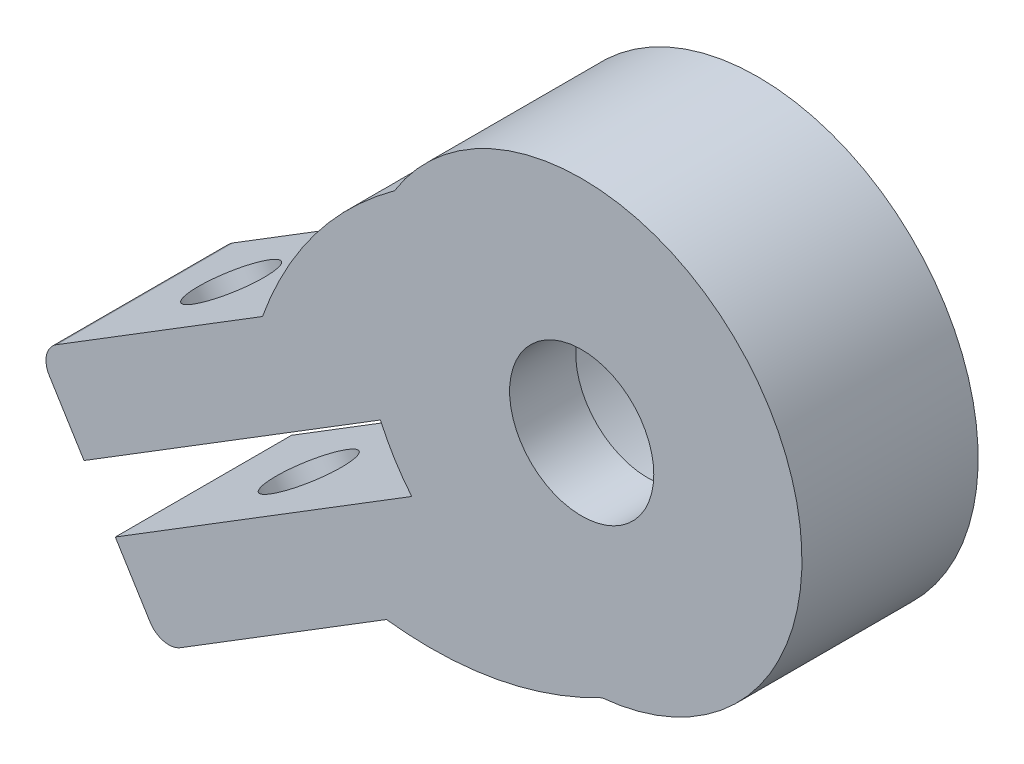
from build123d import *

# Parameters (mm, degrees)
SKETCH1_R               = 10
SKETCH1_R_2             = 6.925
BOSS_EXTRUDE1_DEPTH     = 5
BOSS_EXTRUDE2_START     = 3
SKETCH3_R               = 10
SKETCH3_R_2             = 3.272939667
BOSS_EXTRUDE2_DEPTH     = 3
BOSS_EXTRUDE3_START     = -8
BOSS_EXTRUDE3_DEPTH     = 8
CUT_EXTRUDE1_DEPTH      = 32.194168296
CUT_EXTRUDE1_DEPTH_BACK = 32.194168296
SKETCH5_R               = 1.75
SKETCH6_R               = 3.5
CUT_EXTRUDE2_DEPTH      = 32.194168296


with BuildPart() as part:
    # Sketch1 → Boss-Extrude1 (new body)
    with BuildSketch(Plane.XY):
        Circle(SKETCH1_R)
        Circle(SKETCH1_R_2, mode=Mode.SUBTRACT)
    extrude(amount=-BOSS_EXTRUDE1_DEPTH)

    # Sketch3 → Boss-Extrude2 (add)
    with BuildSketch(Plane.XY.offset(BOSS_EXTRUDE2_START)):
        Circle(SKETCH3_R)
        Circle(SKETCH3_R_2, mode=Mode.SUBTRACT)
    extrude(amount=-BOSS_EXTRUDE2_DEPTH)

    # Sketch4 → Boss-Extrude3 (add)
    with BuildSketch(Plane(origin=(0, 0, -5), x_dir=(-1, 0, 0), z_dir=(0, 0, -1)).offset(BOSS_EXTRUDE3_START)):
        with BuildLine():
            add(Edge.make_bspline(
                [(8.498319818, 5.270537), (12.759977843, 2.15344034), (14.492799423, -2.673176889)],
                knots=[0, 0, 0, 1, 1, 1], degree=2))
            ThreePointArc((8.498319818, 5.270537), (9.617255278, 2.740146147), (10, 0))
            ThreePointArc((10, 0), (9.78187229, -2.077251673), (9.137005098, -4.063882115))
            Line((9.137005098, -4.063882115), (22.594413904, -12.387282242))
            Line((22.594413904, -12.387282242), (24.172466522, -9.835861082))
            ThreePointArc((24.172466522, -9.835861082), (24.295319106, -9.080418377), (23.848010342, -8.459369823))
            Line((23.848010342, -8.459369823), (14.492799423, -2.673176889))
        make_face()
        with BuildLine():
            add(Edge.make_bspline(
                [(-0.920254083, -9.957566591), (3.772003923, -12.378462192), (8.864411751, -11.773245691)],
                knots=[0, 0, 0, 1, 1, 1], degree=2))
            Line((8.864411751, -11.773245691), (18.219622669, -17.559438625))
            ThreePointArc((18.219622669, -17.559438625), (18.975065374, -17.682291209), (19.596113929, -17.234982445))
            Line((19.596113929, -17.234982445), (21.174166547, -14.683561285))
            Line((21.174166547, -14.683561285), (7.716757741, -6.360161159))
            ThreePointArc((7.716757741, -6.360161159), (3.844924831, -9.231281224), (-0.920254083, -9.957566591))
        make_face()
    extrude(amount=BOSS_EXTRUDE3_DEPTH)

    # Sketch5 → Cut-Extrude1 (cut, two sides: drawn at the far end of the back side and taken through both)
    with BuildSketch(Plane(origin=(2.814193836, -4.550034401, 0), x_dir=(0.8504737198659906, 0.526017539457863, 0), z_dir=(0.526017539457863, -0.8504737198659906, 0)).offset(-CUT_EXTRUDE1_DEPTH_BACK)):
        with Locations((-10.421994874, -1)):
            Circle(SKETCH5_R)
        with Locations((-20.108842695, -1)):
            Circle(SKETCH5_R)
    extrude(amount=CUT_EXTRUDE1_DEPTH + CUT_EXTRUDE1_DEPTH_BACK, mode=Mode.SUBTRACT)

    # Sketch6 → Cut-Extrude2 (cut, through all)
    with BuildSketch(Plane(origin=(2.814193836, -4.550034401, 0), x_dir=(0.8504737198659906, 0.526017539457863, 0), z_dir=(0.526017539457863, -0.8504737198659906, 0))):
        with Locations((-10.421994874, -1)):
            Circle(SKETCH6_R)
    cut_extrude2 = extrude(amount=CUT_EXTRUDE2_DEPTH, mode=Mode.SUBTRACT)

    # Mirror1: Cut-Extrude2 across plane
    add(cut_extrude2.mirror(Plane(origin=(0, 0, 0), x_dir=(0, 0, 1), z_dir=(0.526017539457863, -0.8504737198659906, 0))), mode=Mode.SUBTRACT)


solid = part.part
